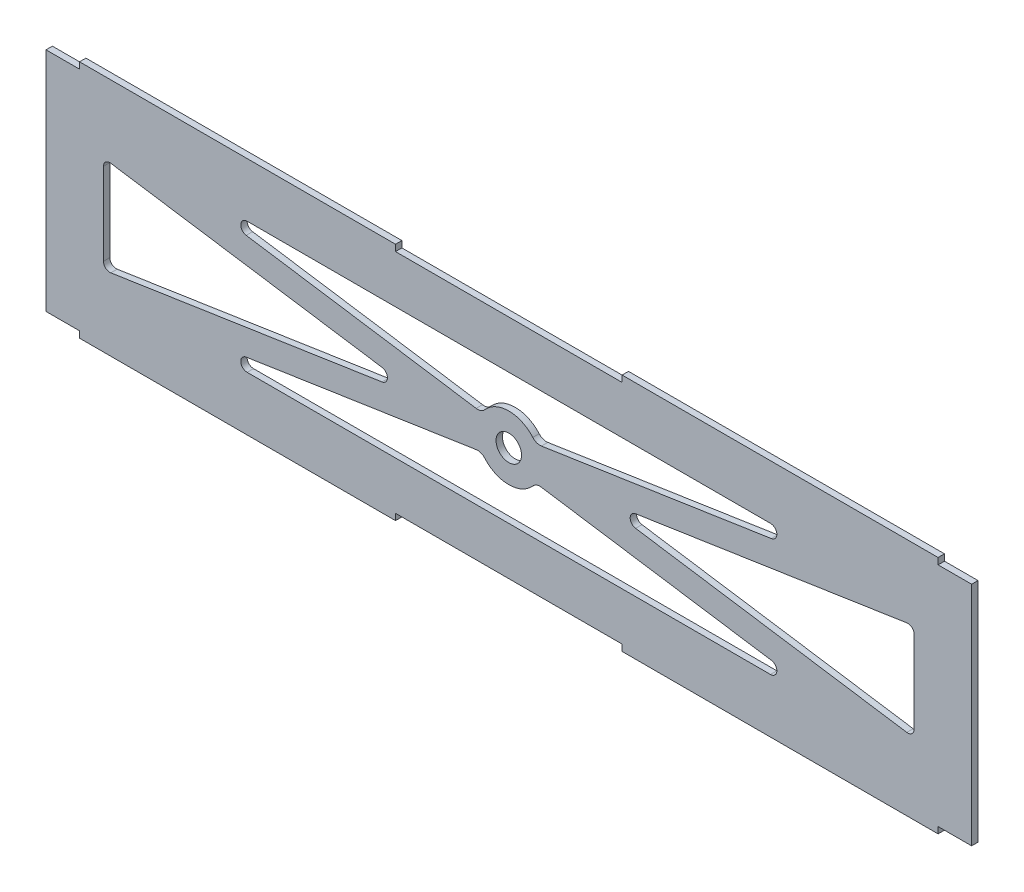
from build123d import *

# Parameters (mm, degrees)
SKETCH_1_W               = 290
SKETCH_1_H               = 71
EXTRUDE_1_DEPTH          = 2
SKETCH_2_W               = 99
SKETCH_2_H               = 4
EXTRUDE_2_DEPTH          = 2
MIRROR_2_COPY_1_SKETCH_W = 99
MIRROR_2_COPY_1_SKETCH_H = 4
MIRROR_2_COPY_1_DEPTH    = 2
CUT_EXTRUDE_1_DEPTH      = 2
SKETCH_4_R               = 10
EXTRUDE_3_DEPTH          = 2
SKETCH_5_R               = 4
CUT_EXTRUDE_2_DEPTH      = 119
FILLET_1_R               = 2
FILLET_2_R               = 3


with BuildPart() as part:
    # 草图1 → 凸台-拉伸1 (new body)
    with BuildSketch(Plane.XY):
        Rectangle(SKETCH_1_W, SKETCH_1_H)
    extrude(amount=EXTRUDE_1_DEPTH)

    # 草图2 → 凸台-拉伸2 (add)
    with BuildSketch(Plane.XY.offset(2)):
        with Locations((-85, 35.5)):
            Rectangle(SKETCH_2_W, SKETCH_2_H)
    extrude_2 = extrude(amount=-EXTRUDE_2_DEPTH)

    # 镜向1: 凸台-拉伸2 across plane
    add(extrude_2.mirror(Plane(origin=(0, 0, 0), x_dir=(0, 0, 1), z_dir=(1, 0, 0))))

    # 镜向2: 凸台-拉伸2 across plane
    add(extrude_2.mirror(Plane.ZX))

    # 镜向2 copy 1 sketch → 镜向2 copy 1 (add)
    with BuildSketch(Plane(origin=(0, 0, 2), x_dir=(-1, 0, 0), z_dir=(0, 0, 1))):
        with Locations((-85, 35.5)):
            Rectangle(MIRROR_2_COPY_1_SKETCH_W, MIRROR_2_COPY_1_SKETCH_H)
    extrude(amount=-MIRROR_2_COPY_1_DEPTH)

    # 草图3 → 切除-拉伸1 (cut)
    with BuildSketch(Plane.XY.offset(2)):
        with BuildLine():
            Line((-122, -20.5), (122, -20.5))
            ThreePointArc((122, -20.5), (125.535533906, -19.035533906), (127, -15.5))
            Line((127, -15.5), (127, 15.5))
            ThreePointArc((127, 15.5), (125.535533906, 19.035533906), (122, 20.5))
            Line((122, 20.5), (-122, 20.5))
            ThreePointArc((-122, 20.5), (-125.535533906, 19.035533906), (-127, 15.5))
            Line((-127, 15.5), (-127, -15.5))
            ThreePointArc((-127, -15.5), (-125.535533906, -19.035533906), (-122, -20.5))
        make_face()
    extrude(amount=-CUT_EXTRUDE_1_DEPTH, mode=Mode.SUBTRACT)

    # 草图4 → 凸台-拉伸3 (add)
    # profile 1 of 4: a face of its own
    with BuildSketch(Plane.XY.offset(2)):
        Polygon((-145, 35.5), (-145, -35.5), (-134.5, -35.5), (-134.5, -37.5), (-35.5, -37.5), (-35.5, -35.5), (35.5, -35.5), (35.5, -37.5), (134.5, -37.5), (134.5, -35.5), (145, -35.5), (145, 35.5), (134.5, 35.5), (134.5, 37.5), (35.5, 37.5), (35.5, 35.5), (-35.5, 35.5), (-35.5, 37.5), (-134.5, 37.5), (-134.5, 35.5), align=None)
        Polygon((-127, 15.2118729), (-130.048778092, 15.67417323), (-124.935850494, 22.990325911), (-108.512649841, 20.5), (108.512649841, 20.5), (124.935850494, 22.990325911), (132.904602809, 16.107215147), (127, 15.2118729), (127, -15.2118729), (132.970266959, -16.117172106), (124.935850494, -22.990325911), (108.512649841, -20.5), (-108.512649841, -20.5), (-124.935850494, -22.990325911), (-130.138762831, -15.687818033), (-127, -15.2118729), align=None, mode=Mode.SUBTRACT)
    # profile 2 of 4: a face of its own
    with BuildSketch(Plane.XY.offset(2)):
        Circle(SKETCH_4_R)
    # profile 3 of 4: a face of its own
    with BuildSketch(Plane.XY.offset(2)):
        with BuildLine():
            Line((122, 20.5), (108.512649841, 20.5))
            Line((108.512649841, 20.5), (8.461883449, 5.32883932))
            ThreePointArc((8.461883449, 5.32883932), (9.607778996, 2.773189996), (10, 0))
            ThreePointArc((10, 0), (9.607778996, -2.773189996), (8.461883449, -5.32883932))
            Line((8.461883449, -5.32883932), (108.512649841, -20.5))
            Line((108.512649841, -20.5), (122, -20.5))
            ThreePointArc((122, -20.5), (125.535533906, -19.035533906), (127, -15.5))
            Line((127, -15.5), (127, -15.2118729))
            Line((127, -15.2118729), (26.68074467, 0))
            Line((26.68074467, 0), (127, 15.2118729))
            Line((127, 15.2118729), (127, 15.5))
            ThreePointArc((127, 15.5), (125.535533906, 19.035533906), (122, 20.5))
        make_face()
    # profile 4 of 4: a face of its own
    with BuildSketch(Plane.XY.offset(2)):
        with BuildLine():
            Line((-127, 15.5), (-127, 15.2118729))
            Line((-127, 15.2118729), (-26.68074467, 0))
            Line((-26.68074467, 0), (-127, -15.2118729))
            Line((-127, -15.2118729), (-127, -15.5))
            ThreePointArc((-127, -15.5), (-125.535533906, -19.035533906), (-122, -20.5))
            Line((-122, -20.5), (-108.512649841, -20.5))
            Line((-108.512649841, -20.5), (-8.461883449, -5.32883932))
            ThreePointArc((-8.461883449, -5.32883932), (-10, 0), (-8.461883449, 5.32883932))
            Line((-8.461883449, 5.32883932), (-108.512649841, 20.5))
            Line((-108.512649841, 20.5), (-122, 20.5))
            ThreePointArc((-122, 20.5), (-125.535533906, 19.035533906), (-127, 15.5))
        make_face()
    extrude(amount=-EXTRUDE_3_DEPTH)

    # 草图5 → 切除-拉伸2 (cut)
    with BuildSketch(Plane.XY.offset(2)):
        Circle(SKETCH_5_R)
    extrude(amount=-CUT_EXTRUDE_2_DEPTH, mode=Mode.SUBTRACT)

    # 圆角1
    fillet_1_edges = [part.edges().sort_by_distance(p)[0] for p in [
        (108.512649841, -20.5, 1),
        (127, -15.2118729, 1),
        (26.68074467, 0, 1),
        (127, 15.2118729, 1),
        (108.512649841, 20.5, 1),
        (-108.512649841, 20.5, 1),
        (-127, 15.2118729, 1),
        (-26.68074467, 0, 1),
        (-127, -15.2118729, 1),
        (-108.512649841, -20.5, 1),
    ]]
    fillet(fillet_1_edges, radius=FILLET_1_R)

    # 圆角2
    fillet_2_edges = [part.edges().sort_by_distance(p)[0] for p in [
        (8.461883449, -5.32883932, 1),
        (8.461883449, 5.32883932, 1),
        (-8.461883449, 5.32883932, 1),
        (-8.461883449, -5.32883932, 1),
    ]]
    fillet(fillet_2_edges, radius=FILLET_2_R)


solid = part.part
